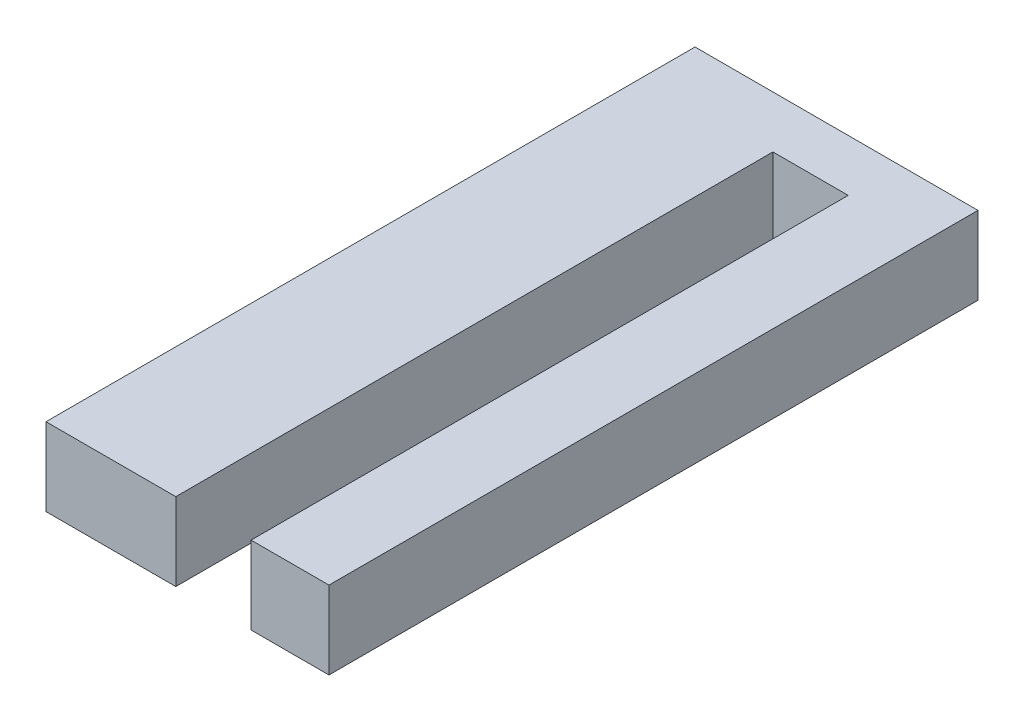
from build123d import *

# Parameters (mm, degrees)
EXTRUDE_1_DEPTH = 3


with BuildPart() as part:
    # 草图1 → 凸台-拉伸1 (new body)
    with BuildSketch(Plane(origin=(0, 0, 0), x_dir=(1, 0, 0), z_dir=(0, 1, 0))):
        Polygon((0, 0), (0, 25), (10.9, 25), (10.9, 0), (7.9, 0), (7.9, 23), (5, 23), (5, 0), align=None)
    extrude(amount=EXTRUDE_1_DEPTH)


solid = part.part
